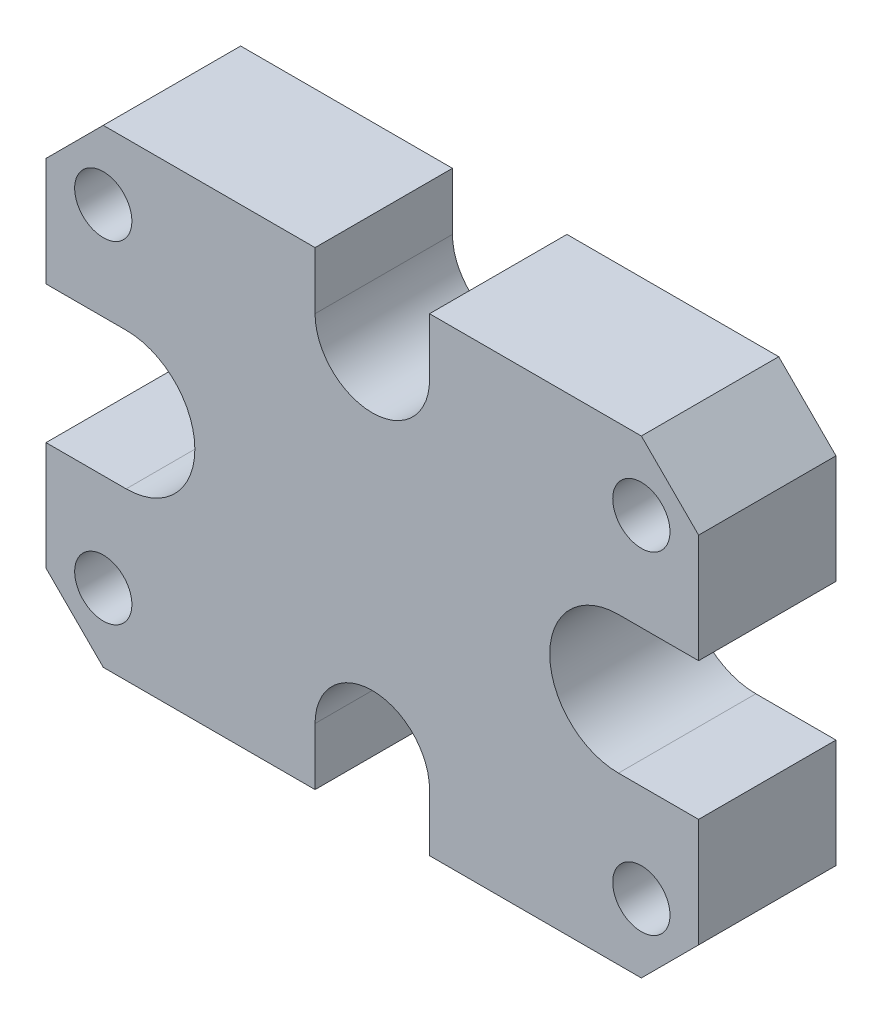
from build123d import *

# Parameters (mm, degrees)
SKETCH1_R           = 5
BOSS_EXTRUDE1_DEPTH = 12


with BuildPart() as part:
    # Sketch1 → Boss-Extrude1 (new, symmetric)
    with BuildSketch(Plane.XY):
        with BuildLine():
            Line((-10, 41), (-10, 31))
            ThreePointArc((-10, 31), (0, 21), (10, 31))
            Line((10, 31), (10, 41))
            Line((10, 41), (47, 41))
            Line((47, 41), (57, 31))
            Line((57, 31), (57, 12))
            Line((57, 12), (43, 12))
            ThreePointArc((43, 12), (31, 0), (43, -12))
            Line((43, -12), (57, -12))
            Line((57, -12), (57, -31))
            Line((57, -31), (47, -41))
            Line((47, -41), (10, -41))
            Line((10, -41), (10, -31))
            ThreePointArc((10, -31), (0, -21), (-10, -31))
            Line((-10, -31), (-10, -41))
            Line((-10, -41), (-47, -41))
            Line((-47, -41), (-57, -31))
            Line((-57, -31), (-57, -12))
            Line((-57, -12), (-43, -12))
            ThreePointArc((-43, -12), (-31, 0), (-43, 12))
            Line((-43, 12), (-57, 12))
            Line((-57, 12), (-57, 31))
            Line((-57, 31), (-47, 41))
            Line((-47, 41), (-10, 41))
        make_face()
        with Locations((-47, 29)):
            Circle(SKETCH1_R, mode=Mode.SUBTRACT)
        with Locations(Location((47, 29, 0), (0, 0, 180))):
            Circle(SKETCH1_R, mode=Mode.SUBTRACT)
        with Locations(Location((-47, -29, 0), (0, 0, 180))):
            Circle(SKETCH1_R, mode=Mode.SUBTRACT)
        with Locations((47, -29)):
            Circle(SKETCH1_R, mode=Mode.SUBTRACT)
    extrude(amount=BOSS_EXTRUDE1_DEPTH, both=True)


solid = part.part
